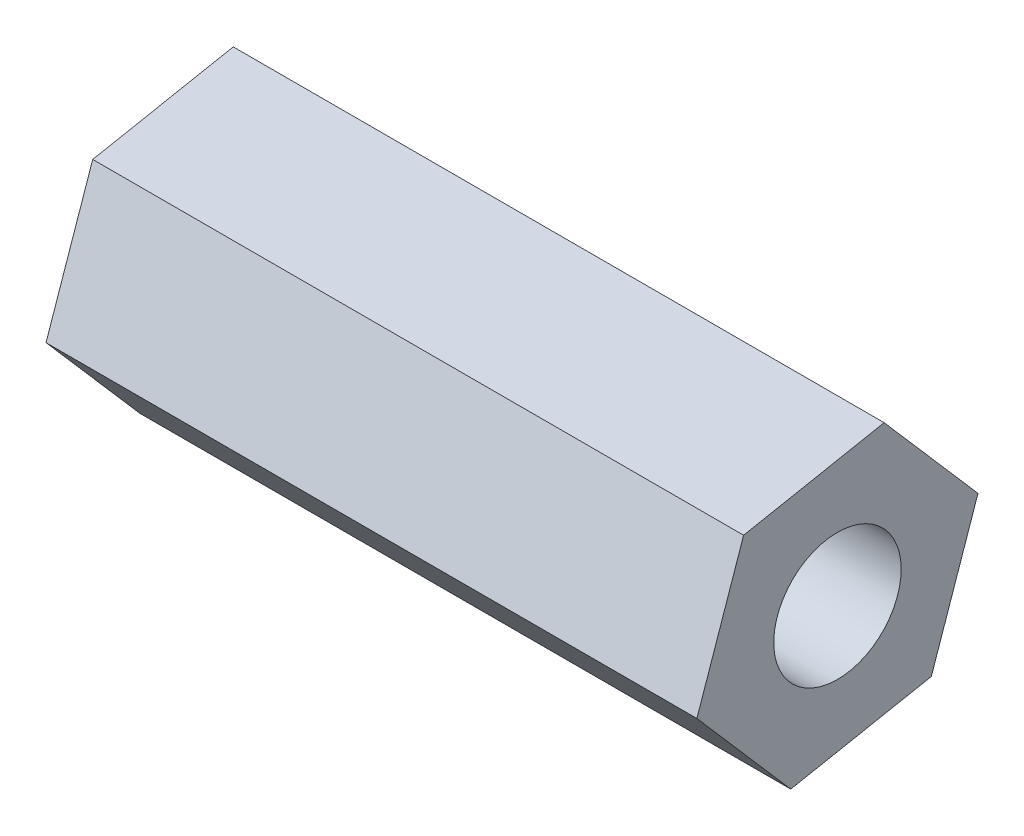
from build123d import *

# Parameters (mm, degrees)
BOSS_EXTRUDE1_DEPTH = 33.3375
SKETCH2_R           = 3.2639
CUT_EXTRUDE1_DEPTH  = 38.1


with BuildPart() as part:
    # Sketch1 → Boss-Extrude1 (new body)
    with BuildSketch(Plane(origin=(0, 0, 0), x_dir=(0, 0, -1), z_dir=(1, 0, 0))):
        Polygon((-4.806155388, 5.53752686), (-7.198716629, -1.39348923), (-2.392561241, -6.93101609), (4.806155388, -5.53752686), (7.198716629, 1.39348923), (2.392561241, 6.93101609), align=None)
    extrude(amount=BOSS_EXTRUDE1_DEPTH)

    # Sketch2 → Cut-Extrude1 (cut)
    with BuildSketch(Plane(origin=(33.3375, 0, 0), x_dir=(0, 0, -1), z_dir=(1, 0, 0))):
        Circle(SKETCH2_R)
    extrude(amount=-CUT_EXTRUDE1_DEPTH, mode=Mode.SUBTRACT)


solid = part.part
